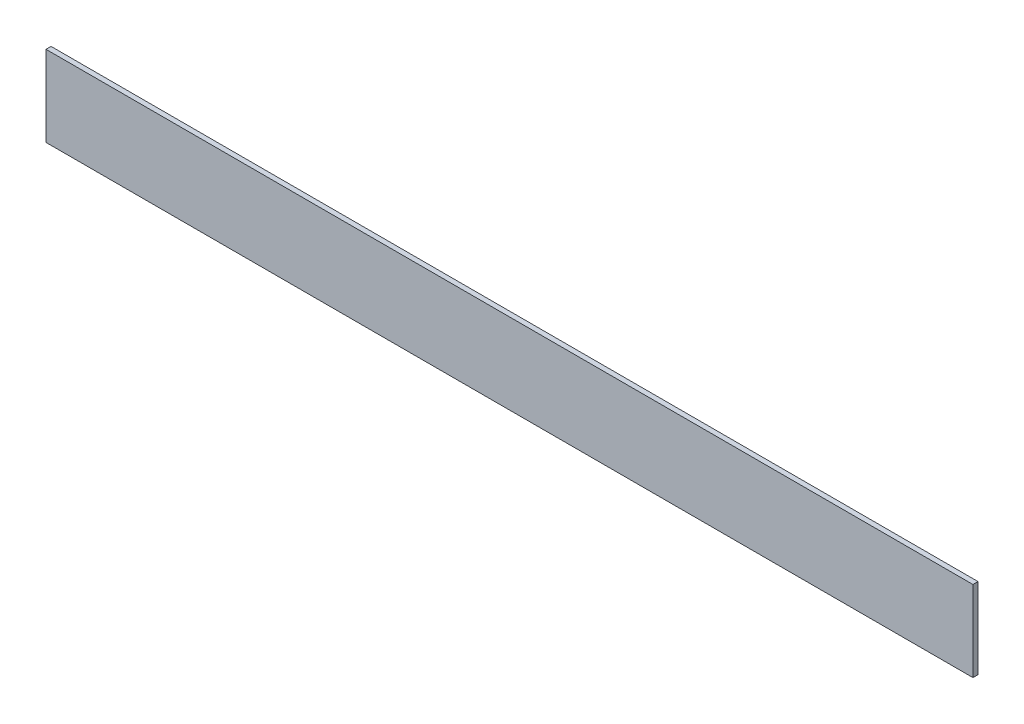
from build123d import *

# Parameters (mm, degrees)
SKETCH_2_W      = 1465
SKETCH_2_H      = 127.5
EXTRUDE_1_DEPTH = 4


with BuildPart() as part:
    # 草图2 → 凸台-拉伸1 (new, symmetric)
    with BuildSketch(Plane.XY.offset(-20)):
        with Locations((-256.593625971, -1323.75)):
            Rectangle(SKETCH_2_W, SKETCH_2_H)
    extrude(amount=EXTRUDE_1_DEPTH, both=True)


solid = part.part
